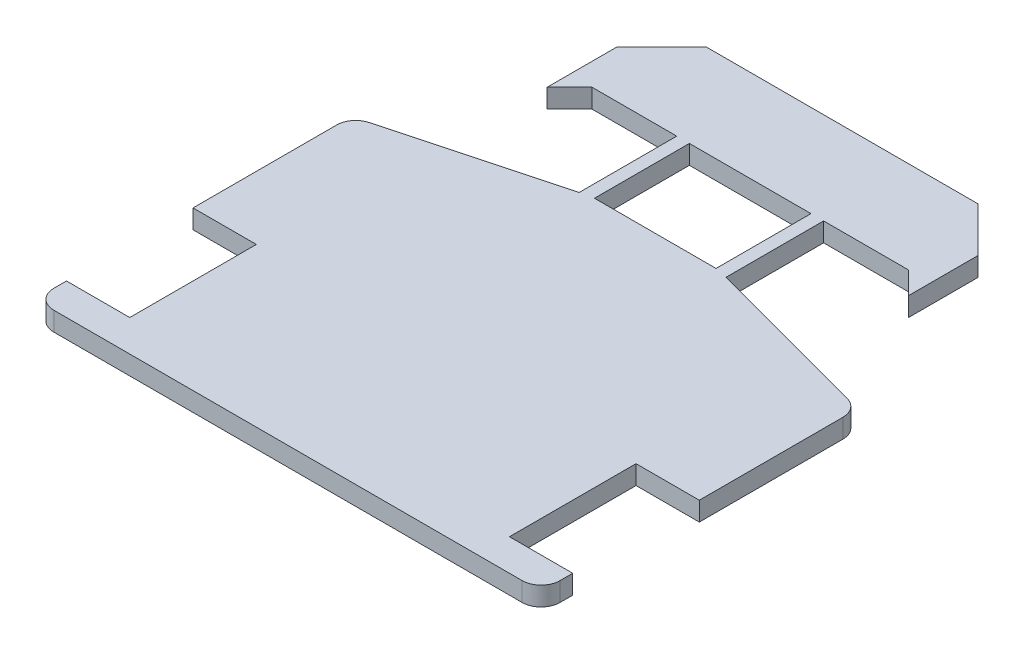
from build123d import *

# Parameters (mm, degrees)
BOSS_EXTRUDE1_DEPTH = 3
BOSS_EXTRUDE2_DEPTH = 3
BOSS_EXTRUDE3_DEPTH = 3


with BuildPart() as part:
    # Sketch1 → Boss-Extrude1 (new body)
    with BuildSketch(Plane(origin=(0, 0, 0), x_dir=(1, 0, 0), z_dir=(0, 1, 0))):
        with BuildLine():
            Line((9.605042507, 58.038475773), (-9.605042507, 58.038475773))
            ThreePointArc((-9.605042507, 58.038475773), (-9.996621084, 58.012810357), (-10.381499643, 57.936253252))
            Line((-10.381499643, 57.936253252), (-37.776457135, 50.595796515))
            ThreePointArc((-37.776457135, 50.595796515), (-39.380060021, 49.524303323), (-40, 47.698019036))
            Line((-40, 47.698019036), (-40, 25))
            Line((-40, 25), (-30, 25))
            Line((-30, 25), (-30, 5))
            Line((-30, 5), (-40, 5))
            Line((-40, 5), (-40, 3))
            ThreePointArc((-40, 3), (-39.121320344, 0.878679656), (-37, 0))
            Line((-37, 0), (37, 0))
            ThreePointArc((37, 0), (39.121320344, 0.878679656), (40, 3))
            Line((40, 3), (40, 5))
            Line((40, 5), (30, 5))
            Line((30, 5), (30, 25))
            Line((30, 25), (40, 25))
            Line((40, 25), (40, 47.698019036))
            ThreePointArc((40, 47.698019036), (39.380060021, 49.524303323), (37.776457135, 50.595796515))
            Line((37.776457135, 50.595796515), (10.381499643, 57.936253252))
            ThreePointArc((10.381499643, 57.936253252), (9.996621084, 58.012810357), (9.605042507, 58.038475773))
        make_face()
    extrude(amount=BOSS_EXTRUDE1_DEPTH)

    # Sketch3 → Boss-Extrude2 (add)
    with BuildSketch(Plane(origin=(0, 3, 0), x_dir=(1, 0, 0), z_dir=(0, 1, 0))):
        Polygon((-11.605042507, 57.608405929), (-9.605042507, 58.038475773), (-9.605042507, 73.038475773), (-11.605042507, 73.038475773), align=None)
        Polygon((9.605042507, 73.038475773), (9.605042507, 58.038475773), (11.605042507, 57.608405929), (11.605042507, 73.038475773), align=None)
    extrude(amount=-BOSS_EXTRUDE2_DEPTH)

    # Sketch4 → Boss-Extrude3 (add)
    with BuildSketch(Plane(origin=(0, 3, 0), x_dir=(1, 0, 0), z_dir=(0, 1, 0))):
        Polygon((0, 73.038475773), (-25, 73.038475773), (-28.535533906, 69.502941867), (-28.535533906, 80.502941867), (-21.464466094, 87.574009679), (21.464466094, 87.574009679), (28.535533906, 80.502941867), (28.535533906, 69.502941867), (25, 73.038475773), align=None)
    extrude(amount=-BOSS_EXTRUDE3_DEPTH)


solid = part.part
